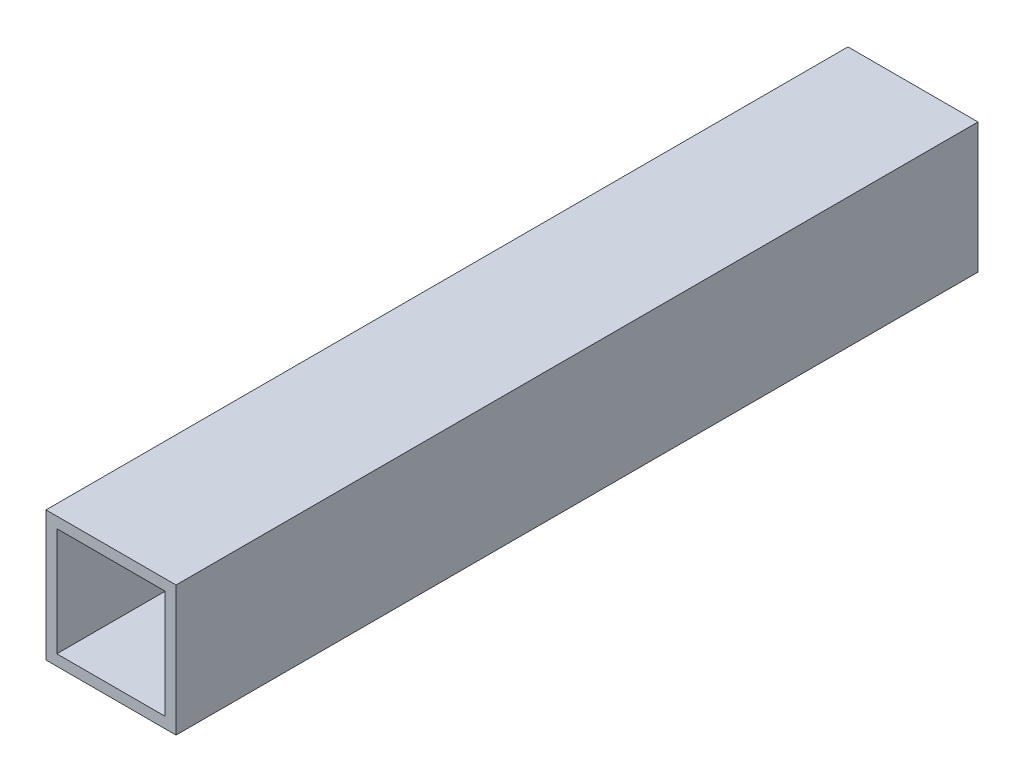
from build123d import *

# Parameters (mm, degrees)
SKETCH_1_W      = 24
SKETCH_1_H      = 24
SKETCH_1_W_2    = 20
SKETCH_1_H_2    = 20
EXTRUDE_1_DEPTH = 148


with BuildPart() as part:
    # 草图1 → 凸台-拉伸1 (new body)
    with BuildSketch(Plane.XY):
        Rectangle(SKETCH_1_W, SKETCH_1_H)
        Rectangle(SKETCH_1_W_2, SKETCH_1_H_2, mode=Mode.SUBTRACT)
    extrude(amount=EXTRUDE_1_DEPTH)


solid = part.part
